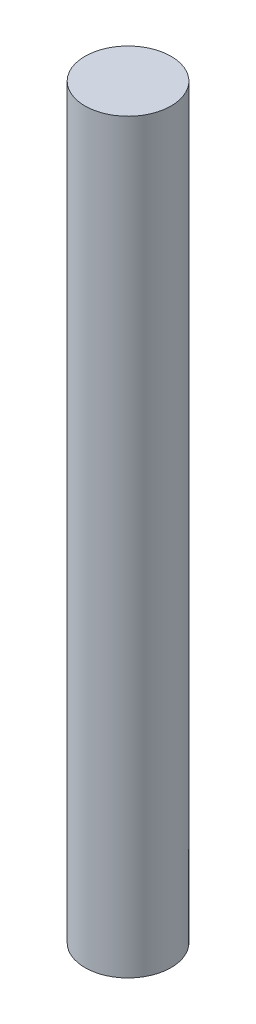
from build123d import *

# Parameters (mm, degrees)
SKETCH_1_R      = 3
EXTRUDE_1_DEPTH = 52


with BuildPart() as part:
    # 草图1 → 凸台-拉伸1 (new body)
    with BuildSketch(Plane(origin=(0, 0, 0), x_dir=(1, 0, 0), z_dir=(0, 1, 0))):
        with Locations(Location((0, 0, 0), (0, 0, 90))):
            Circle(SKETCH_1_R)
    extrude(amount=EXTRUDE_1_DEPTH)


solid = part.part
